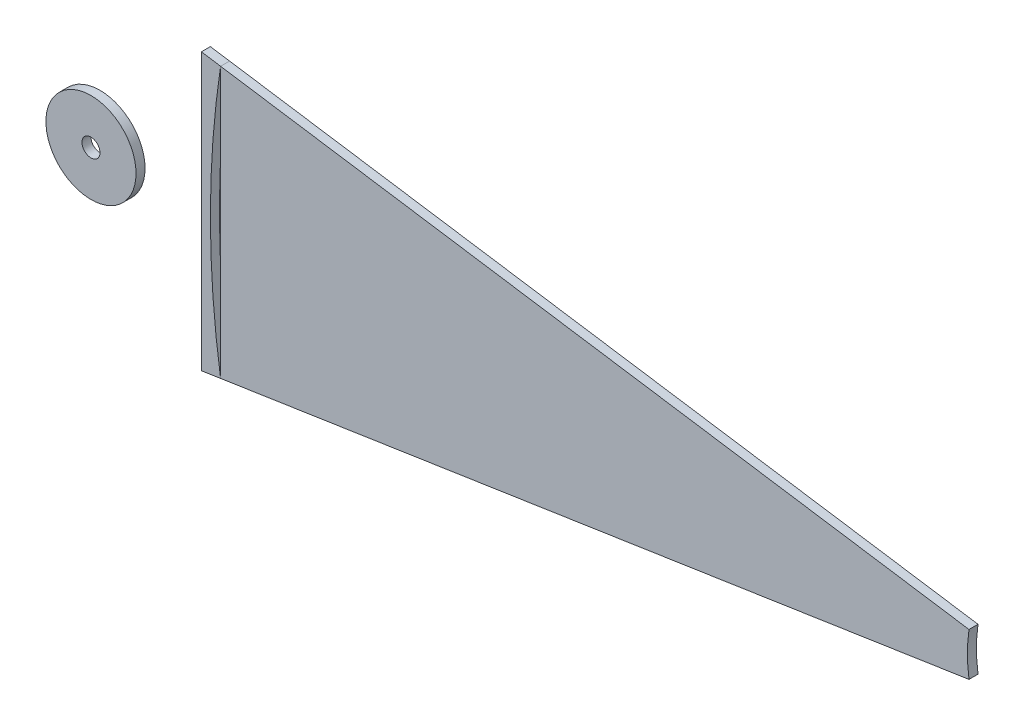
from build123d import *

# Parameters (mm, degrees)
BOSS_EXTRUDE1_DEPTH        = 0.5
BOSS_EXTRUDE1_DEPTH_BACK   = 0.5
BOSS_EXTRUDE1_2_DEPTH      = 0.5
BOSS_EXTRUDE1_2_DEPTH_BACK = 0.5
BOSS_EXTRUDE2_DEPTH        = 0.5
BOSS_EXTRUDE2_DEPTH_BACK   = 0.5
SKETCH2_R                  = 5
SKETCH2_R_2                = 1


with BuildPart() as part:
    # Sketch1 → Boss-Extrude1 (new, two sides: drawn at the far end of the back side and taken through both)
    with BuildSketch(Plane.XY.offset(-BOSS_EXTRUDE1_DEPTH_BACK)):
        with BuildLine():
            ThreePointArc((-15.818975947, -2.4), (-16, 0), (-15.818975947, 2.4))
            Line((-15.818975947, 2.4), (-98.868599666, 15))
            Line((-98.868599666, 15), (-98.868599666, -15))
            Line((-98.868599666, -15), (-15.818975947, -2.4))
        make_face()
    extrude(amount=BOSS_EXTRUDE1_DEPTH + BOSS_EXTRUDE1_DEPTH_BACK)


with BuildPart() as body_2:
    # Sketch1 → Boss-Extrude1 2 (new, two sides: drawn at the far end of the back side and taken through both)
    with BuildSketch(Plane.XY.offset(-BOSS_EXTRUDE1_2_DEPTH_BACK)):
        with BuildLine():
            ThreePointArc((-98.868599666, -15), (-100, 0), (-98.868599666, 15))
            Line((-98.868599666, 15), (-101, 15.323368644))
            Line((-101, 15.323368644), (-101, -15.323368644))
            Line((-101, -15.323368644), (-98.868599666, -15))
        make_face()
    extrude(amount=BOSS_EXTRUDE1_2_DEPTH + BOSS_EXTRUDE1_2_DEPTH_BACK)


with BuildPart() as body_3:
    # Sketch2 → Boss-Extrude2 (new, two sides: drawn at the far end of the back side and taken through both)
    with BuildSketch(Plane.XY.offset(-BOSS_EXTRUDE2_DEPTH_BACK)):
        with Locations((-113.25, 0)):
            Circle(SKETCH2_R)
        with Locations((-113.25, 0)):
            Circle(SKETCH2_R_2, mode=Mode.SUBTRACT)
    extrude(amount=BOSS_EXTRUDE2_DEPTH + BOSS_EXTRUDE2_DEPTH_BACK)


solid = Compound([part.part, body_2.part, body_3.part])
